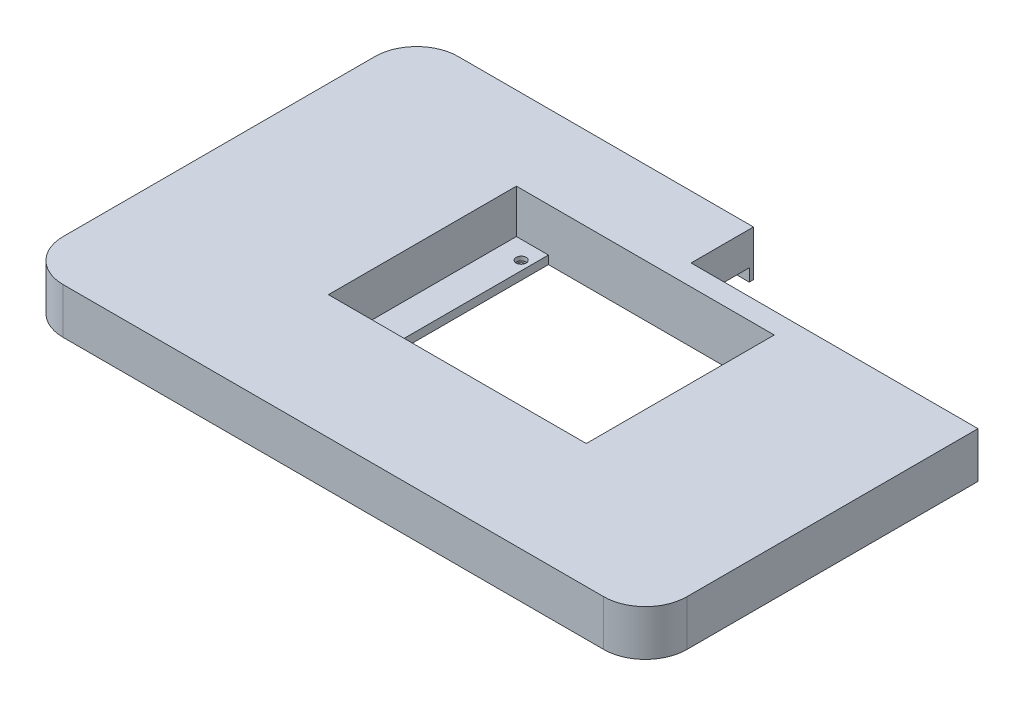
from build123d import *

# Parameters (mm, degrees)
EXTRUDE_1_DEPTH      = 1
SKETCH_2_W           = 69
SKETCH_2_H           = 15
CUT_EXTRUDE_1_DEPTH  = 1
EXTRUDE_START        = 10
EXTRUDE_2_DEPTH      = 10
SKETCH_4_R           = 2.5
EXTRUDE_3_DEPTH      = 10
SKETCH_5_R           = 1.5
CUT_EXTRUDE_2_DEPTH  = 2.8
SKETCH_6_R           = 1.1
CUT_EXTRUDE_4_DEPTH  = 4.2
EXTRUDE_4_DEPTH      = 7
SKETCH_8_R           = 2.5
EXTRUDE_5_DEPTH      = 10
SKETCH_9_R           = 1.5
CUT_EXTRUDE_5_DEPTH  = 2.8
SKETCH_10_R          = 1.1
CUT_EXTRUDE_6_DEPTH  = 4.2
SKETCH_11_W          = 62
SKETCH_11_H          = 45.2
CUT_EXTRUDE_7_DEPTH  = 10
SKETCH_12_R          = 2.5
CUT_EXTRUDE_8_DEPTH  = 10
SKETCH_13_W          = 66
SKETCH_13_H          = 49.2
SKETCH_13_W_2        = 62
SKETCH_13_H_2        = 45.2
EXTRUDE_6_DEPTH      = 11.5
SKETCH_14_W          = 7.7
SKETCH_14_H          = 45.2
SKETCH_14_R          = 1.2
EXTRUDE_9_DEPTH      = 2
SKETCH_16_R          = 2
CUT_EXTRUDE_12_DEPTH = 1
SKETCH_17_R          = 1.6
CUT_EXTRUDE_13_DEPTH = 2.8
SKETCH_18_R          = 1.2
CUT_EXTRUDE_14_DEPTH = 2
SKETCH_19_R          = 3.5
SKETCH_19_R_2        = 2.5
EXTRUDE_10_DEPTH     = 10
FILLET_2_R           = 2
SKETCH_20_W          = 62
SKETCH_20_H          = 45.2
CUT_EXTRUDE_15_DEPTH = 10.5
SKETCH_21_W          = 13.5
SKETCH_21_H          = 5
CUT_EXTRUDE_22_DEPTH = 15
SKETCH_24_W          = 10
SKETCH_24_H          = 10
SKETCH_24_W_2        = 5
EXTRUDE_11_DEPTH     = 5
SKETCH_25_W          = 5
SKETCH_25_H          = 10
EXTRUDE_12_DEPTH     = 1.6
SKETCH_27_W          = 11
SKETCH_27_H          = 5
EXTRUDE_13_DEPTH     = 1
SKETCH_28_W          = 11
SKETCH_28_H          = 5
EXTRUDE_14_DEPTH     = 1


with BuildPart() as part:
    # 스케치1 → 보스-돌출1 (new body)
    with BuildSketch(Plane(origin=(0, 0, 0), x_dir=(1, 0, 0), z_dir=(0, 1, 0))):
        with BuildLine():
            Line((-65, 47.5), (65, 47.5))
            ThreePointArc((65, 47.5), (72.071067812, 44.571067812), (75, 37.5))
            Line((75, 37.5), (75, -37.5))
            ThreePointArc((75, -37.5), (72.071067812, -44.571067812), (65, -47.5))
            Line((65, -47.5), (-65, -47.5))
            ThreePointArc((-65, -47.5), (-72.071067812, -44.571067812), (-75, -37.5))
            Line((-75, -37.5), (-75, 37.5))
            ThreePointArc((-75, 37.5), (-72.071067812, 44.571067812), (-65, 47.5))
        make_face()
    extrude(amount=EXTRUDE_1_DEPTH)

    # 스케치2 → 컷-돌출1 (cut)
    with BuildSketch(Plane(origin=(0, 1, 0), x_dir=(1, 0, 0), z_dir=(0, 1, 0))):
        with Locations((40.5, 40)):
            Rectangle(SKETCH_2_W, SKETCH_2_H)
    extrude(amount=-CUT_EXTRUDE_1_DEPTH, mode=Mode.SUBTRACT)

    # 스케치3 → 보스-돌출2 (add)
    with BuildSketch(Plane.XZ.offset(EXTRUDE_START)):
        with BuildLine():
            Line((74, 37.5), (74, -31.5))
            Line((74, -31.5), (74, -32.5))
            Line((74, -32.5), (75, -32.5))
            Line((75, -32.5), (75, 37.5))
            ThreePointArc((75, 37.5), (72.071067812, 44.571067812), (65, 47.5))
            Line((65, 47.5), (-65, 47.5))
            ThreePointArc((-65, 47.5), (-72.071067812, 44.571067812), (-75, 37.5))
            Line((-75, 37.5), (-75, -37.5))
            ThreePointArc((-75, -37.5), (-72.071067812, -44.571067812), (-65, -47.5))
            Line((-65, -47.5), (6, -47.5))
            Line((6, -47.5), (6, -46.5))
            Line((6, -46.5), (5, -46.5))
            Line((5, -46.5), (-65, -46.5))
            ThreePointArc((-65, -46.5), (-71.363961031, -43.863961031), (-74, -37.5))
            Line((-74, -37.5), (-74, 37.5))
            ThreePointArc((-74, 37.5), (-71.363961031, 43.863961031), (-65, 46.5))
            Line((-65, 46.5), (65, 46.5))
            ThreePointArc((65, 46.5), (71.363961031, 43.863961031), (74, 37.5))
        make_face()
    extrude(amount=-EXTRUDE_2_DEPTH)

    # 스케치4 → 보스-돌출3 (add)
    with BuildSketch(Plane.XZ):
        with Locations((-60, 32.5)):
            Circle(SKETCH_4_R)
        with Locations((59.999632967, 32.5)):
            Circle(SKETCH_4_R)
        with Locations((-60, -24.5)):
            Circle(SKETCH_4_R)
        with Locations((59.999632967, -24.5)):
            Circle(SKETCH_4_R)
    extrude(amount=EXTRUDE_3_DEPTH)

    # 스케치5 → 컷-돌출2 (cut)
    with BuildSketch(Plane.XZ.offset(10)):
        with Locations((-60, -24.5)):
            Circle(SKETCH_5_R)
        with Locations((-60, 32.5)):
            Circle(SKETCH_5_R)
        with Locations((59.999632967, 32.5)):
            Circle(SKETCH_5_R)
        with Locations((59.999632967, -24.5)):
            Circle(SKETCH_5_R)
    extrude(amount=-CUT_EXTRUDE_2_DEPTH, mode=Mode.SUBTRACT)

    # 스케치6 → 컷-돌출4 (cut)
    with BuildSketch(Plane.XZ.offset(7.2)):
        with Locations((-60, -24.5)):
            Circle(SKETCH_6_R)
        with Locations((-60, 32.5)):
            Circle(SKETCH_6_R)
        with Locations((59.999632967, 32.5)):
            Circle(SKETCH_6_R)
        with Locations((59.999632967, -24.5)):
            Circle(SKETCH_6_R)
    extrude(amount=-CUT_EXTRUDE_4_DEPTH, mode=Mode.SUBTRACT)

    # 스케치7 → 보스-돌출4 (add)
    with BuildSketch(Plane.XZ):
        Polygon((5, -46.5), (6, -46.5), (6, -32.5), (74, -32.5), (74, -31.5), (5, -31.5), align=None)
    extrude(amount=EXTRUDE_4_DEPTH)

    # 스케치8 → 보스-돌출5 (add)
    with BuildSketch(Plane.XZ):
        with Locations((0, 32.5)):
            Circle(SKETCH_8_R)
        with Locations((0, -24.5)):
            Circle(SKETCH_8_R)
    extrude(amount=EXTRUDE_5_DEPTH)

    # 스케치9 → 컷-돌출5 (cut)
    with BuildSketch(Plane.XZ.offset(10)):
        with Locations((0, 32.5)):
            Circle(SKETCH_9_R)
        with Locations((0, -24.5)):
            Circle(SKETCH_9_R)
    extrude(amount=-CUT_EXTRUDE_5_DEPTH, mode=Mode.SUBTRACT)

    # 스케치10 → 컷-돌출6 (cut)
    with BuildSketch(Plane.XZ.offset(7.2)):
        with Locations((0, 32.5)):
            Circle(SKETCH_10_R)
        with Locations((0, -24.5)):
            Circle(SKETCH_10_R)
    extrude(amount=-CUT_EXTRUDE_6_DEPTH, mode=Mode.SUBTRACT)

    # 스케치11 → 컷-돌출7 (cut)
    with BuildSketch(Plane(origin=(0, 1, 0), x_dir=(1, 0, 0), z_dir=(0, 1, 0))):
        with Locations((0, 4.9)):
            Rectangle(SKETCH_11_W, SKETCH_11_H)
    extrude(amount=-CUT_EXTRUDE_7_DEPTH, mode=Mode.SUBTRACT)


with BuildPart() as cut_extrude_7_piece_1:
    # of the separate pieces the step leaves, piece 1, a body of its own (cut_extrude_7_pieces)
    add(part.part.solids().sort_by_distance((6, 1, -47.5))[0])

    # 스케치13 → 보스-돌출6 (add)
    with BuildSketch(Plane.XZ):
        with Locations((0, -4.9)):
            Rectangle(SKETCH_13_W, SKETCH_13_H)
        with Locations((0, -4.9)):
            Rectangle(SKETCH_13_W_2, SKETCH_13_H_2, mode=Mode.SUBTRACT)
    extrude(amount=EXTRUDE_6_DEPTH)

    # 스케치14 → 보스-돌출9 (add)
    # profile 1 of 2: a face of its own
    with BuildSketch(Plane.XZ.offset(11.5)):
        with Locations((-27.15, -4.9)):
            Rectangle(SKETCH_14_W, SKETCH_14_H)
        with Locations((-25.5, 13.35)):
            Circle(SKETCH_14_R, mode=Mode.SUBTRACT)
        with Locations((-25.5, -23.15)):
            Circle(SKETCH_14_R, mode=Mode.SUBTRACT)
    # profile 2 of 2: a face of its own
    with BuildSketch(Plane.XZ.offset(11.5)):
        with Locations((27.15, -4.9)):
            Rectangle(SKETCH_14_W, SKETCH_14_H)
        with Locations((25.5, 13.35)):
            Circle(SKETCH_14_R, mode=Mode.SUBTRACT)
        with Locations((25.5, -23.15)):
            Circle(SKETCH_14_R, mode=Mode.SUBTRACT)
    extrude(amount=-EXTRUDE_9_DEPTH)

    # 스케치16 → 컷-돌출12 (cut)
    with BuildSketch(Plane.XZ.offset(11.5)):
        with Locations((-25.5, 13.35)):
            Circle(SKETCH_16_R)
        with Locations((-25.5, -23.15)):
            Circle(SKETCH_16_R)
        with Locations((25.5, -23.15)):
            Circle(SKETCH_16_R)
        with Locations((25.5, 13.35)):
            Circle(SKETCH_16_R)
    extrude(amount=-CUT_EXTRUDE_12_DEPTH, mode=Mode.SUBTRACT)

    # 스케치17 → 컷-돌출13 (cut)
    with BuildSketch(Plane.XZ.offset(10)):
        with Locations((-60, -24.5)):
            Circle(SKETCH_17_R)
        with Locations((-60, 32.5)):
            Circle(SKETCH_17_R)
        with Locations((59.999632967, 32.5)):
            Circle(SKETCH_17_R)
        with Locations((0, 32.5)):
            Circle(SKETCH_17_R)
        with Locations((59.999632967, -24.5)):
            Circle(SKETCH_17_R)
    extrude(amount=-CUT_EXTRUDE_13_DEPTH, mode=Mode.SUBTRACT)

    # 스케치18 → 컷-돌출14 (cut)
    with BuildSketch(Plane.XZ.offset(7.2)):
        with Locations((-60, -24.5)):
            Circle(SKETCH_18_R)
        with Locations((-60, 32.5)):
            Circle(SKETCH_18_R)
        with Locations((0, 32.5)):
            Circle(SKETCH_18_R)
        with Locations((59.999632967, 32.5)):
            Circle(SKETCH_18_R)
        with Locations((59.999632967, -24.5)):
            Circle(SKETCH_18_R)
    extrude(amount=-CUT_EXTRUDE_14_DEPTH, mode=Mode.SUBTRACT)

    # 스케치19 → 보스-돌출10 (add)
    # profile 1 of 5: a face of its own
    with BuildSketch(Plane.XZ):
        with Locations((-60, 32.5)):
            Circle(SKETCH_19_R)
        with Locations((-60, 32.5)):
            Circle(SKETCH_19_R_2, mode=Mode.SUBTRACT)
    # profile 2 of 5: a face of its own
    with BuildSketch(Plane.XZ):
        with Locations((-60, -24.5)):
            Circle(SKETCH_19_R)
        with Locations((-60, -24.5)):
            Circle(SKETCH_19_R_2, mode=Mode.SUBTRACT)
    # profile 3 of 5: a face of its own
    with BuildSketch(Plane.XZ):
        with Locations((59.999632967, -24.5)):
            Circle(SKETCH_19_R)
        with Locations((59.999632967, -24.5)):
            Circle(SKETCH_19_R_2, mode=Mode.SUBTRACT)
    # profile 4 of 5: a face of its own
    with BuildSketch(Plane.XZ):
        with Locations((59.999632967, 32.5)):
            Circle(SKETCH_19_R)
        with Locations((59.999632967, 32.5)):
            Circle(SKETCH_19_R_2, mode=Mode.SUBTRACT)
    # profile 5 of 5: a face of its own
    with BuildSketch(Plane.XZ):
        with Locations((0, 32.5)):
            Circle(SKETCH_19_R)
        with Locations((0, 32.5)):
            Circle(SKETCH_19_R_2, mode=Mode.SUBTRACT)
    extrude(amount=EXTRUDE_10_DEPTH)

    # 필렛2
    fillet_2_edges = [cut_extrude_7_piece_1.edges().sort_by_distance(p)[0] for p in [
        (31, -4.25, 17.7),
        (31, -4.25, -27.5),
        (-31, -4.25, -27.5),
        (-31, -4.25, 17.7),
    ]]
    fillet(fillet_2_edges, radius=FILLET_2_R)

    # 스케치20 → 컷-돌출15 (cut)
    with BuildSketch(Plane(origin=(0, 1, 0), x_dir=(1, 0, 0), z_dir=(0, 1, 0))):
        with Locations((0, 4.9)):
            Rectangle(SKETCH_20_W, SKETCH_20_H)
    extrude(amount=-CUT_EXTRUDE_15_DEPTH, mode=Mode.SUBTRACT)

    # 스케치21 → 컷-돌출22 (cut)
    with BuildSketch(Plane.XY.offset(-46.5)):
        with Locations((-42, -2.5)):
            Rectangle(SKETCH_21_W, SKETCH_21_H)
        with Locations((-18, -2.5)):
            Rectangle(SKETCH_21_W, SKETCH_21_H)
    extrude(amount=-CUT_EXTRUDE_22_DEPTH, mode=Mode.SUBTRACT)

    # 스케치24 → 보스-돌출11 (add)
    with BuildSketch(Plane.XZ):
        with Locations((-6.25, -41.5)):
            Rectangle(SKETCH_24_W, SKETCH_24_H)
        with Locations((-53.75, -41.5)):
            Rectangle(SKETCH_24_W, SKETCH_24_H)
        with Locations((-30, -41.5)):
            Rectangle(SKETCH_24_W_2, SKETCH_24_H)
    extrude(amount=EXTRUDE_11_DEPTH)

    # 스케치25 → 보스-돌출12 (add)
    with BuildSketch(Plane.XZ.offset(5)):
        with Locations((-56.25, -41.5)):
            Rectangle(SKETCH_25_W, SKETCH_25_H)
        with Locations((-3.75, -41.5)):
            Rectangle(SKETCH_25_W, SKETCH_25_H)
    extrude(amount=EXTRUDE_12_DEPTH)

    # 스케치27 → 보스-돌출13 (add)
    with BuildSketch(Plane.ZY.offset(11.25)):
        with Locations((-42, -2.5)):
            Rectangle(SKETCH_27_W, SKETCH_27_H)
    extrude(amount=EXTRUDE_13_DEPTH)

    # 스케치28 → 보스-돌출14 (add)
    with BuildSketch(Plane(origin=(-48.75, 0, 0), x_dir=(0, 0, -1), z_dir=(1, 0, 0))):
        with Locations((42, -2.5)):
            Rectangle(SKETCH_28_W, SKETCH_28_H)
    extrude(amount=EXTRUDE_14_DEPTH)


with BuildPart() as cut_extrude_7_piece_2:
    # of the separate pieces the step leaves, piece 2, a body of its own (cut_extrude_7_pieces)
    add(part.part.solids().sort_by_distance((2.5, -9, -24.5))[0])

    # 스케치12 → 컷-돌출8 (cut)
    with BuildSketch(Plane.XZ.offset(10)):
        with Locations((0, -24.5)):
            Circle(SKETCH_12_R)
    extrude(amount=-CUT_EXTRUDE_8_DEPTH, mode=Mode.SUBTRACT)


solid = cut_extrude_7_piece_1.part
